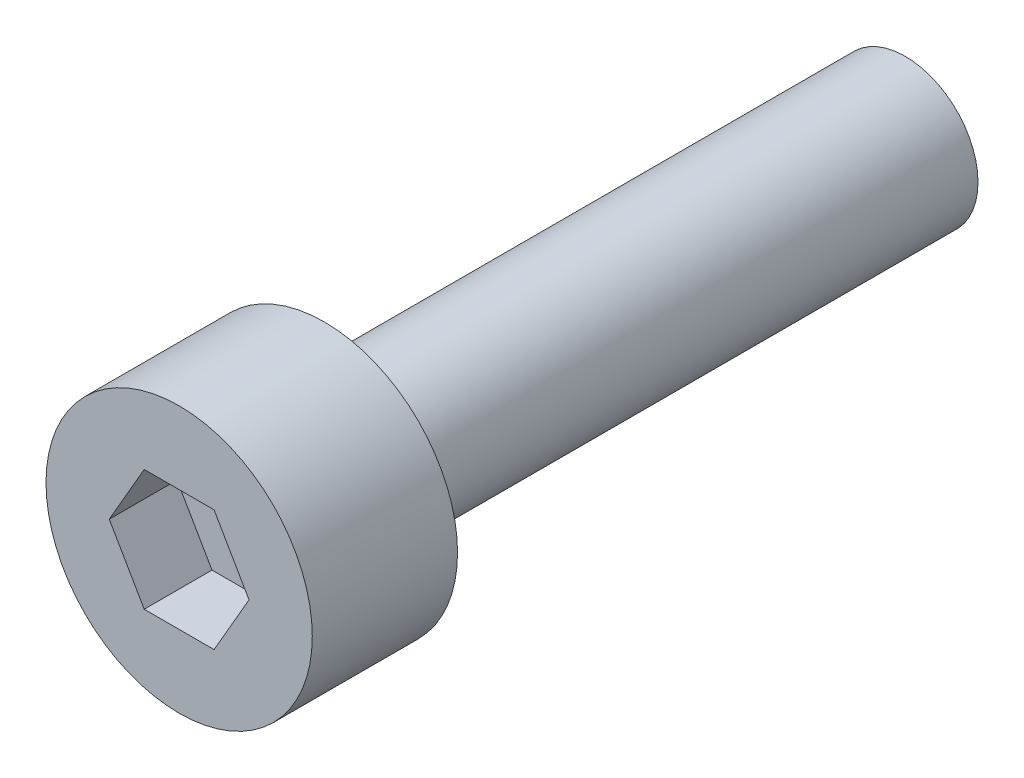
from build123d import *

# Parameters (mm, degrees)
ISO4762_HEAD_D5P5_H3_SKETCH_R       = 2.75
ISO4762_HEAD_D5P5_H3_DEPTH          = 3
M3_MAJOR_DIAMETER_ENVELOPE_START    = -12
M3_MAJOR_DIAMETER_ENVELOPE_SKETCH_R = 1.5
M3_MAJOR_DIAMETER_ENVELOPE_DEPTH    = 12
HEX_SOCKET_2P5AF_START              = 1.6
HEX_SOCKET_2P5AF_DEPTH              = 1.4


with BuildPart() as part:
    # ISO4762_head_D5p5_h3_Sketch → ISO4762_head_D5p5_h3 (new body)
    with BuildSketch(Plane.XY):
        Circle(ISO4762_HEAD_D5P5_H3_SKETCH_R)
    extrude(amount=ISO4762_HEAD_D5P5_H3_DEPTH)

    # M3_major_diameter_envelope_Sketch → M3_major_diameter_envelope (add)
    with BuildSketch(Plane.XY.offset(M3_MAJOR_DIAMETER_ENVELOPE_START)):
        Circle(M3_MAJOR_DIAMETER_ENVELOPE_SKETCH_R)
    extrude(amount=M3_MAJOR_DIAMETER_ENVELOPE_DEPTH)

    # Hex_socket_2p5AF_Sketch → Hex_socket_2p5AF (cut)
    with BuildSketch(Plane.XY.offset(HEX_SOCKET_2P5AF_START)):
        Polygon((1.443375673, 0), (0.721687836, 1.25), (-0.721687836, 1.25), (-1.443375673, 0), (-0.721687836, -1.25), (0.721687836, -1.25), align=None)
    extrude(amount=HEX_SOCKET_2P5AF_DEPTH, mode=Mode.SUBTRACT)


solid = part.part
